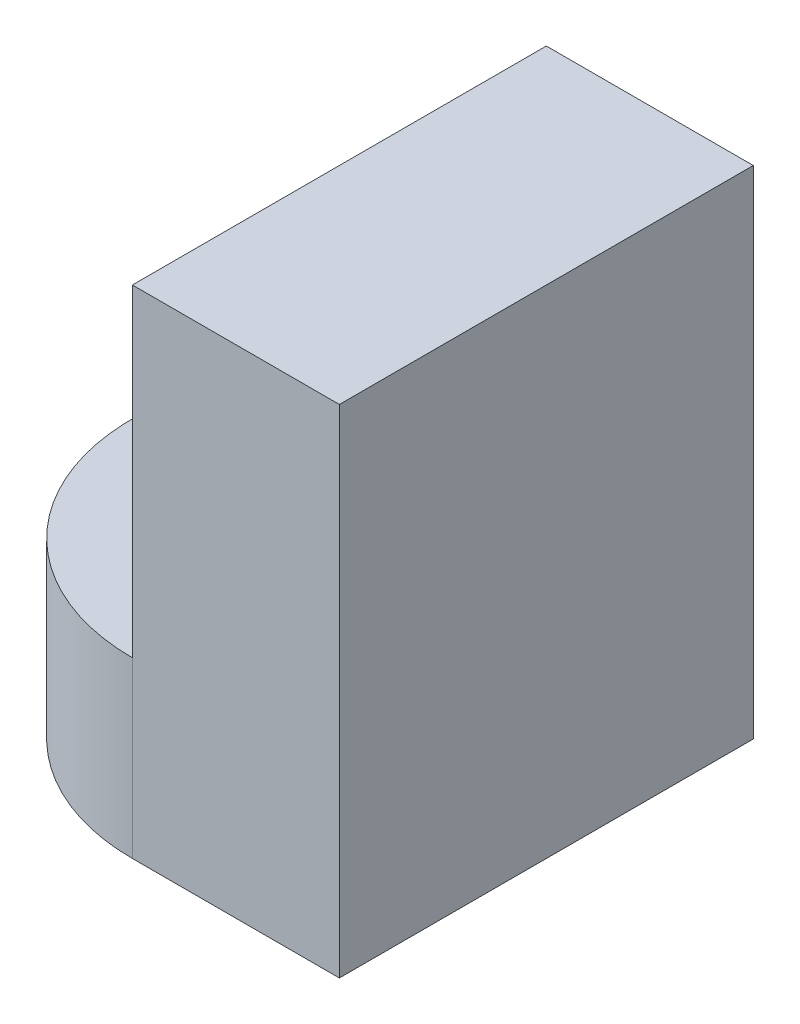
from build123d import *

# Parameters (mm, degrees)
SKETCH1_R           = 2.5
BOSS_EXTRUDE2_DEPTH = 2.1
SKETCH10_W          = 5
SKETCH10_H          = 6
BOSS_EXTRUDE5_DEPTH = 2.5
SKETCH12_R          = 1
CUT_EXTRUDE1_DEPTH  = 2


with BuildPart() as part:
    # Sketch1 → Boss-Extrude2 (new body)
    with BuildSketch(Plane(origin=(0, 0, 0), x_dir=(1, 0, 0), z_dir=(0, 1, 0))):
        with Locations(Location((0, 0, 0), (0, 0, 270))):
            Circle(SKETCH1_R)
    extrude(amount=BOSS_EXTRUDE2_DEPTH)

    # Sketch10 → Boss-Extrude5 (add)
    with BuildSketch(Plane(origin=(2.5, 0, 0), x_dir=(0, 0, -1), z_dir=(1, 0, 0))):
        with Locations((0, 3)):
            Rectangle(SKETCH10_W, SKETCH10_H)
    extrude(amount=-BOSS_EXTRUDE5_DEPTH)

    # Sketch11 → Cut-Revolve2 (revolve, cut)
    with BuildSketch(Plane.ZY):
        with BuildLine():
            Line((-1.386997153, 4), (1.613002847, 4))
            ThreePointArc((1.613002847, 4), (0.113002847, 5.5), (-1.386997153, 4))
        make_face()
    revolve(axis=Axis((0, 4, -1.386997153), (0, 0, 1)), mode=Mode.SUBTRACT)

    # Sketch12 → Cut-Extrude1 (cut)
    with BuildSketch(Plane.XZ):
        with Locations(Location((0, 0, 0), (0, 0, 270))):
            Circle(SKETCH12_R)
    extrude(amount=-CUT_EXTRUDE1_DEPTH, mode=Mode.SUBTRACT)


solid = part.part
